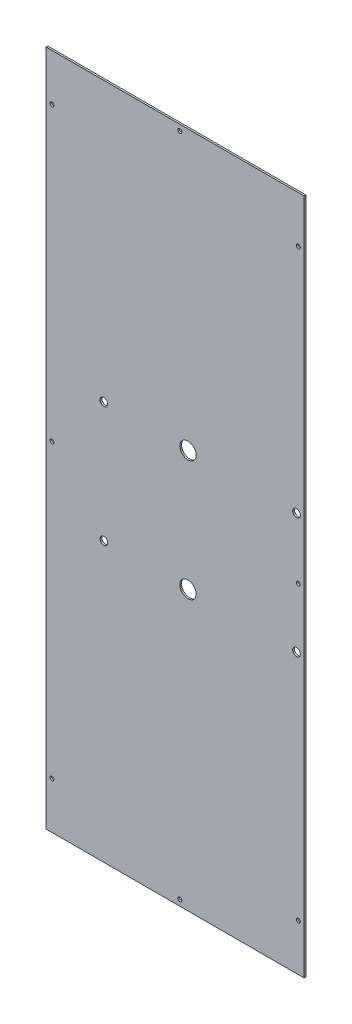
from build123d import *

# Parameters (mm, degrees)
MAIN_PROFILE_SKETCH_W   = 221
MAIN_PROFILE_SKETCH_H   = 580
MAIN_PROFILE_SKETCH_R   = 1.7
MAIN_PROFILE_SKETCH_R_2 = 3.3
MAIN_PROFILE_SKETCH_R_3 = 7
MAIN_EXTRUSION_DEPTH    = 1.5


with BuildPart() as part:
    # Main Profile Sketch → Main Extrusion (new body)
    with BuildSketch(Plane.XY.offset(111.5)):
        with Locations((-29, 0)):
            Rectangle(MAIN_PROFILE_SKETCH_W, MAIN_PROFILE_SKETCH_H)
        with Locations((-134.5, -250)):
            Circle(MAIN_PROFILE_SKETCH_R, mode=Mode.SUBTRACT)
        with Locations((-90, -51.5)):
            Circle(MAIN_PROFILE_SKETCH_R_2, mode=Mode.SUBTRACT)
        with Locations((-25, -285)):
            Circle(MAIN_PROFILE_SKETCH_R, mode=Mode.SUBTRACT)
        with Locations((76.5, -250)):
            Circle(MAIN_PROFILE_SKETCH_R, mode=Mode.SUBTRACT)
        with Locations((-18, -51.5)):
            Circle(MAIN_PROFILE_SKETCH_R_3, mode=Mode.SUBTRACT)
        with Locations((75, -51.5)):
            Circle(MAIN_PROFILE_SKETCH_R_2, mode=Mode.SUBTRACT)
        with Locations((-134.5, 0)):
            Circle(MAIN_PROFILE_SKETCH_R, mode=Mode.SUBTRACT)
        with Locations((-90, 51.5)):
            Circle(MAIN_PROFILE_SKETCH_R_2, mode=Mode.SUBTRACT)
        with Locations((-134.5, 250)):
            Circle(MAIN_PROFILE_SKETCH_R, mode=Mode.SUBTRACT)
        with Locations((-18, 51.5)):
            Circle(MAIN_PROFILE_SKETCH_R_3, mode=Mode.SUBTRACT)
        with Locations((76.5, 0)):
            Circle(MAIN_PROFILE_SKETCH_R, mode=Mode.SUBTRACT)
        with Locations((75, 51.5)):
            Circle(MAIN_PROFILE_SKETCH_R_2, mode=Mode.SUBTRACT)
        with Locations((-25, 285)):
            Circle(MAIN_PROFILE_SKETCH_R, mode=Mode.SUBTRACT)
        with Locations((76.5, 250)):
            Circle(MAIN_PROFILE_SKETCH_R, mode=Mode.SUBTRACT)
    extrude(amount=-MAIN_EXTRUSION_DEPTH)


solid = part.part
